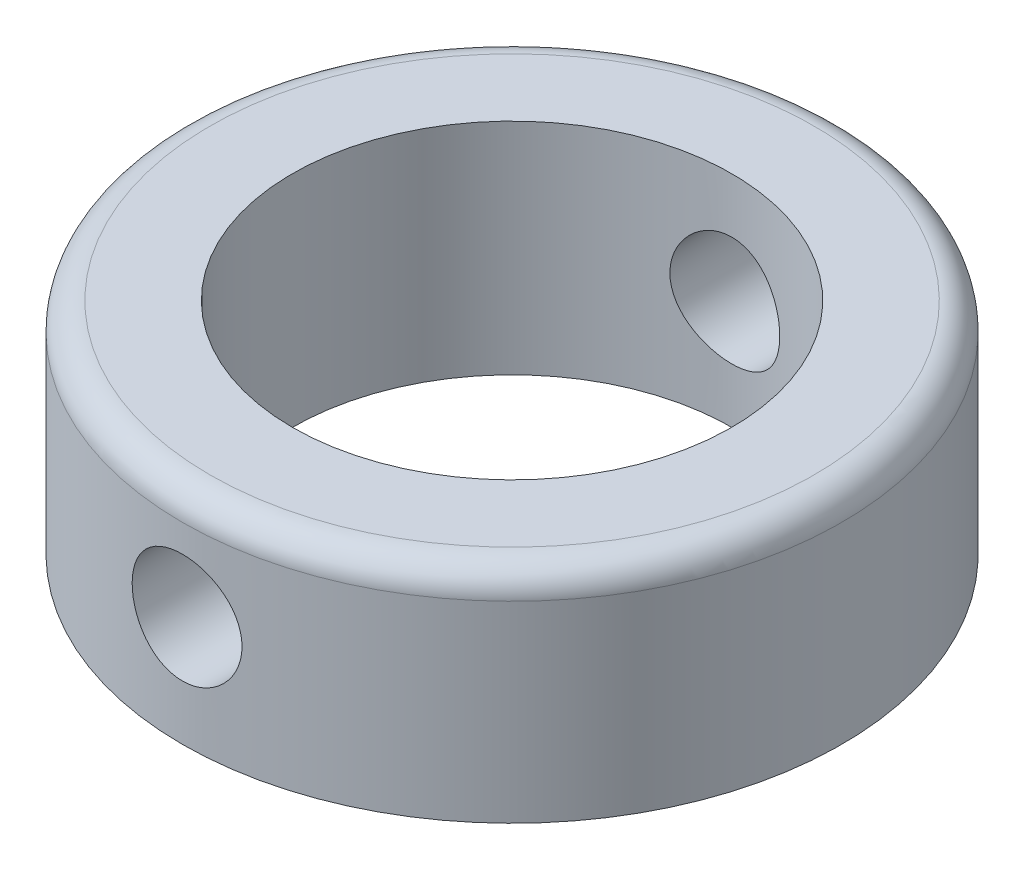
from build123d import *

# Parameters (mm, degrees)
SKETCH1_R           = 12
SKETCH1_R_2         = 8
BOSS_EXTRUDE1_DEPTH = 8
SKETCH2_R           = 2
CUT_EXTRUDE1_DEPTH  = 21
FILLET1_R           = 1


with BuildPart() as part:
    # Sketch1 → Boss-Extrude1 (new body)
    with BuildSketch(Plane(origin=(0, 0, 0), x_dir=(1, 0, 0), z_dir=(0, 1, 0))):
        with Locations(Location((0, 0, 0), (0, 0, 270))):
            Circle(SKETCH1_R)
        with Locations(Location((0, 0, 0), (0, 0, 270))):
            Circle(SKETCH1_R_2, mode=Mode.SUBTRACT)
    extrude(amount=BOSS_EXTRUDE1_DEPTH)

    # Sketch2 → Cut-Extrude1 (cut, symmetric)
    with BuildSketch(Plane.XY):
        with Locations((0, 4)):
            Circle(SKETCH2_R)
    extrude(amount=CUT_EXTRUDE1_DEPTH, both=True, mode=Mode.SUBTRACT)

    # Fillet1
    fillet1_edges = [part.edges().sort_by_distance(p)[0] for p in [
        (0, 8, -12),
    ]]
    fillet(fillet1_edges, radius=FILLET1_R)


solid = part.part
